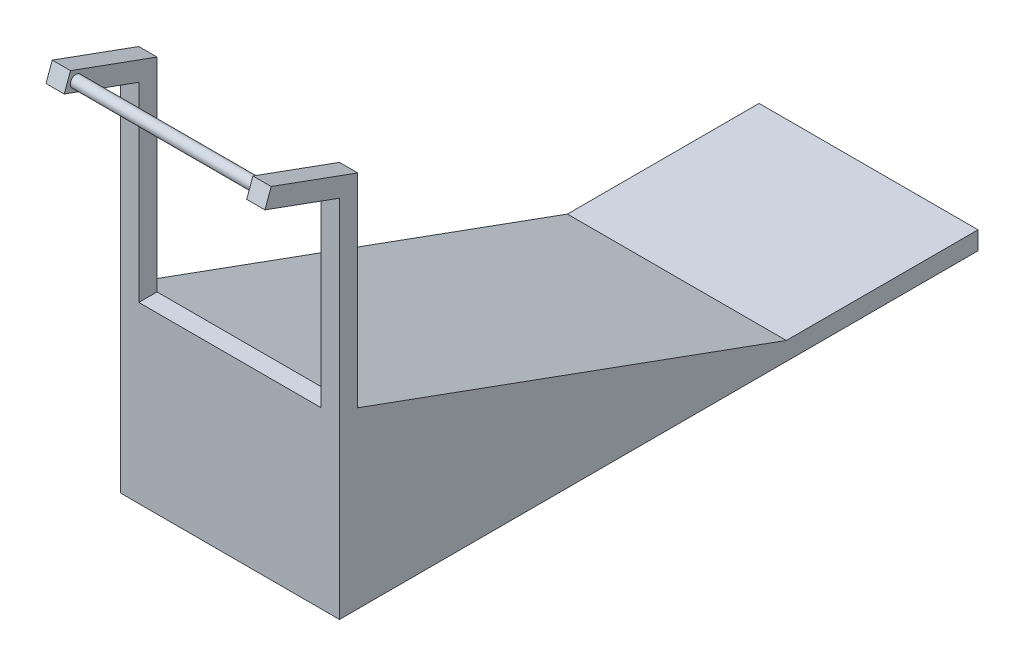
from build123d import *

# Parameters (mm, degrees)
BOSS_EXTRUDE1_DEPTH = 24
SKETCH5_W           = 20
SKETCH5_H           = 30.196049995
CUT_EXTRUDE1_DEPTH  = 20
SKETCH6_R           = 0.625
BOSS_EXTRUDE2_DEPTH = 20


with BuildPart() as part:
    # Sketch2 → Boss-Extrude1 (new body)
    with BuildSketch(Plane(origin=(0, 0, 0), x_dir=(0, 0, -1), z_dir=(1, 0, 0))):
        Polygon((0, 0), (70, 0), (70, 2), (48.984631039, 2), (2, 19.101007166), (2, 41.400415076), (-7.490496191, 44.854673198), (-8.174536478, 42.975287957), (0, 40), align=None)
    extrude(amount=BOSS_EXTRUDE1_DEPTH)

    # Sketch5 → Cut-Extrude1 (cut)
    with BuildSketch(Plane(origin=(0, 0, -2), x_dir=(-1, 0, 0), z_dir=(0, 0, -1))):
        with Locations((-12, 34.199032164)):
            Rectangle(SKETCH5_W, SKETCH5_H)
    extrude(amount=-CUT_EXTRUDE1_DEPTH, mode=Mode.SUBTRACT)

    # Sketch6 → Boss-Extrude2 (add)
    with BuildSketch(Plane(origin=(2, 0, 0), x_dir=(0, 0, -1), z_dir=(1, 0, 0))):
        with Locations(Location((-6.892823714, 43.572960434, 0), (0, 0, 270))):
            Circle(SKETCH6_R)
    extrude(amount=BOSS_EXTRUDE2_DEPTH)


solid = part.part
